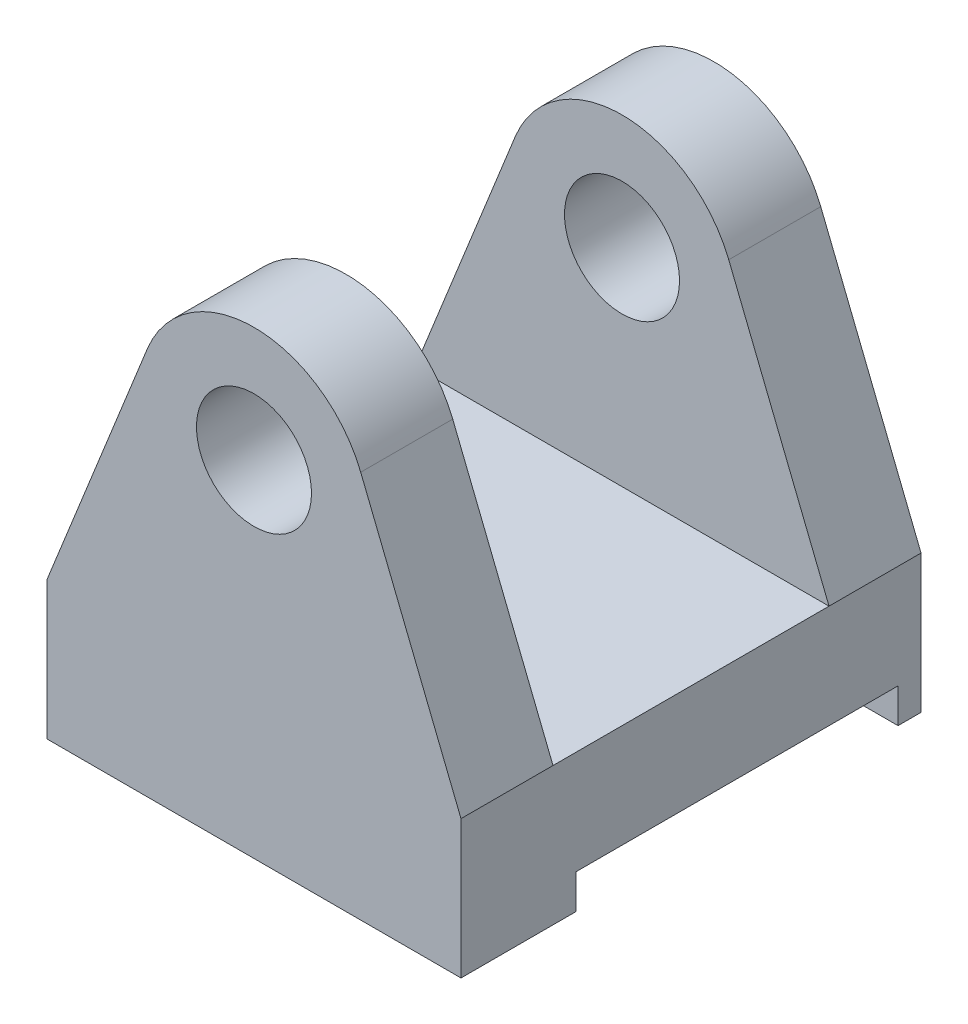
from build123d import *

# Parameters (mm, degrees)
SKETCH_1_R               = 5
SKETCH_1_W               = 18
SKETCH_1_H               = 6
EXTRUDE_1_DEPTH          = 10
CUT_EXTRUDE_1_DEPTH      = 27.702059846
CUT_EXTRUDE_1_DEPTH_BACK = 27.702059846
SKETCH_2_W               = 14
SKETCH_2_H               = 3
CUT_EXTRUDE_START        = -4
CUT_EXTRUDE_2_DEPTH      = 12
CUT_EXTRUDE_3_DEPTH      = 28.748873851
CUT_EXTRUDE_3_DEPTH_BACK = 28.748873851
SKETCH_4_R               = 2.5


with BuildPart() as part:
    # 草图1 → 凸台-拉伸1 (new, symmetric)
    with BuildSketch(Plane.XY):
        with Locations((0, 12)):
            Circle(SKETCH_1_R)
        with BuildLine():
            Line((9, 3), (4.64019442, 13.862416642))
            ThreePointArc((4.64019442, 13.862416642), (4.909224587, 12.948427093), (5, 12))
            ThreePointArc((5, 12), (-0.948427093, 7.090775413), (-4.64019442, 13.862416642))
            Line((-4.64019442, 13.862416642), (-9, 3))
            Line((-9, 3), (9, 3))
        make_face()
        Rectangle(SKETCH_1_W, SKETCH_1_H)
    extrude(amount=EXTRUDE_1_DEPTH, both=True)

    # 草图2 → 切除-拉伸1 (cut, two sides: drawn at the far end of the back side and taken through both)
    with BuildSketch(Plane(origin=(9, 0, 0), x_dir=(0, 0, -1), z_dir=(1, 0, 0)).offset(-CUT_EXTRUDE_1_DEPTH_BACK)):
        with Locations((2, -3)):
            Rectangle(SKETCH_2_W, SKETCH_2_H)
    extrude(amount=CUT_EXTRUDE_1_DEPTH + CUT_EXTRUDE_1_DEPTH_BACK, mode=Mode.SUBTRACT)

    # 草图3 → 切除-拉伸2 (cut)
    with BuildSketch(Plane.XY.offset(10).offset(CUT_EXTRUDE_START)):
        with BuildLine():
            Line((-9, 3), (9, 3))
            Line((9, 3), (4.64019442, 13.862416642))
            ThreePointArc((4.64019442, 13.862416642), (0, 17), (-4.64019442, 13.862416642))
            Line((-4.64019442, 13.862416642), (-9, 3))
        make_face()
    extrude(amount=-CUT_EXTRUDE_2_DEPTH, mode=Mode.SUBTRACT)

    # 草图4 → 切除-拉伸3 (cut, two sides: drawn at the far end of the back side and taken through both)
    with BuildSketch(Plane.XY.offset(10).offset(-CUT_EXTRUDE_3_DEPTH_BACK)):
        with Locations((0, 12)):
            Circle(SKETCH_4_R)
    extrude(amount=CUT_EXTRUDE_3_DEPTH + CUT_EXTRUDE_3_DEPTH_BACK, mode=Mode.SUBTRACT)


solid = part.part
